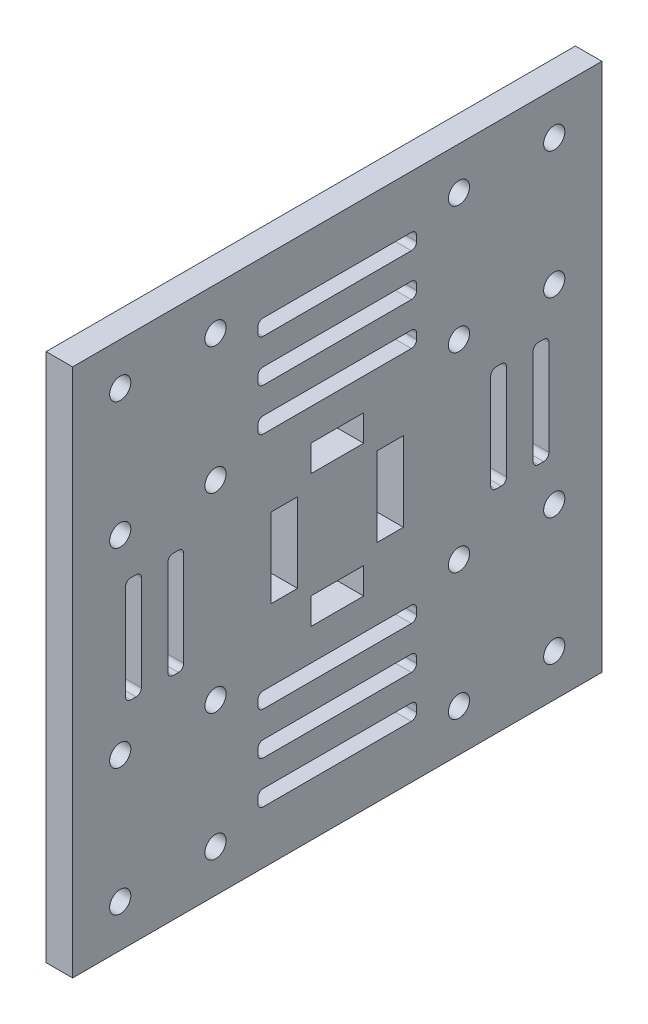
from build123d import *

# Parameters (mm, degrees)
SKETCH_1_W      = 100
SKETCH_1_H      = 100
SKETCH_1_R      = 2
SKETCH_1_W_2    = 5
SKETCH_1_H_2    = 15
SKETCH_1_W_3    = 10
SKETCH_1_H_3    = 5
EXTRUDE_1_DEPTH = 5


with BuildPart() as part:
    # 草图1 → 凸台-拉伸1 (new body)
    with BuildSketch(Plane(origin=(0, 0, 0), x_dir=(0, 0, -1), z_dir=(1, 0, 0))):
        with Locations((-50, 50)):
            Rectangle(SKETCH_1_W, SKETCH_1_H)
        with Locations((-91, 92)):
            Circle(SKETCH_1_R, mode=Mode.SUBTRACT)
        with Locations((-27, 92)):
            Circle(SKETCH_1_R, mode=Mode.SUBTRACT)
        with Locations((-91, 8)):
            Circle(SKETCH_1_R, mode=Mode.SUBTRACT)
        with Locations((-27, 8)):
            Circle(SKETCH_1_R, mode=Mode.SUBTRACT)
        with Locations((-73, 92)):
            Circle(SKETCH_1_R, mode=Mode.SUBTRACT)
        with Locations((-73, 68)):
            Circle(SKETCH_1_R, mode=Mode.SUBTRACT)
        with Locations((-91, 68)):
            Circle(SKETCH_1_R, mode=Mode.SUBTRACT)
        with Locations((-9, 92)):
            Circle(SKETCH_1_R, mode=Mode.SUBTRACT)
        with Locations((-9, 68)):
            Circle(SKETCH_1_R, mode=Mode.SUBTRACT)
        with Locations((-27, 68)):
            Circle(SKETCH_1_R, mode=Mode.SUBTRACT)
        with Locations((-73, 8)):
            Circle(SKETCH_1_R, mode=Mode.SUBTRACT)
        with Locations((-73, 32)):
            Circle(SKETCH_1_R, mode=Mode.SUBTRACT)
        with Locations((-91, 32)):
            Circle(SKETCH_1_R, mode=Mode.SUBTRACT)
        with Locations((-9, 8)):
            Circle(SKETCH_1_R, mode=Mode.SUBTRACT)
        with Locations((-9, 32)):
            Circle(SKETCH_1_R, mode=Mode.SUBTRACT)
        with Locations((-27, 32)):
            Circle(SKETCH_1_R, mode=Mode.SUBTRACT)
        with Locations((-60, 50)):
            Rectangle(SKETCH_1_W_2, SKETCH_1_H_2, mode=Mode.SUBTRACT)
        with Locations((-40, 50)):
            Rectangle(SKETCH_1_W_2, SKETCH_1_H_2, mode=Mode.SUBTRACT)
        with Locations((-50, 37.5)):
            Rectangle(SKETCH_1_W_3, SKETCH_1_H_3, mode=Mode.SUBTRACT)
        with Locations((-50, 62.5)):
            Rectangle(SKETCH_1_W_3, SKETCH_1_H_3, mode=Mode.SUBTRACT)
        with BuildLine():
            Line((-36, 74), (-64, 74))
            ThreePointArc((-64, 74), (-64.707106781, 73.707106781), (-65, 73))
            Line((-65, 73), (-65, 72))
            ThreePointArc((-65, 72), (-64.707106781, 71.292893219), (-64, 71))
            Line((-64, 71), (-36, 71))
            ThreePointArc((-36, 71), (-35.292893219, 71.292893219), (-35, 72))
            Line((-35, 72), (-35, 73))
            ThreePointArc((-35, 73), (-35.292893219, 73.707106781), (-36, 74))
        make_face(mode=Mode.SUBTRACT)
        with BuildLine():
            Line((-36, 82), (-64, 82))
            ThreePointArc((-64, 82), (-64.707106781, 81.707106781), (-65, 81))
            Line((-65, 81), (-65, 80))
            ThreePointArc((-65, 80), (-64.707106781, 79.292893219), (-64, 79))
            Line((-64, 79), (-36, 79))
            ThreePointArc((-36, 79), (-35.292893219, 79.292893219), (-35, 80))
            Line((-35, 80), (-35, 81))
            ThreePointArc((-35, 81), (-35.292893219, 81.707106781), (-36, 82))
        make_face(mode=Mode.SUBTRACT)
        with BuildLine():
            Line((-36, 90), (-64, 90))
            ThreePointArc((-64, 90), (-64.707106781, 89.707106781), (-65, 89))
            Line((-65, 89), (-65, 88))
            ThreePointArc((-65, 88), (-64.707106781, 87.292893219), (-64, 87))
            Line((-64, 87), (-36, 87))
            ThreePointArc((-36, 87), (-35.292893219, 87.292893219), (-35, 88))
            Line((-35, 88), (-35, 89))
            ThreePointArc((-35, 89), (-35.292893219, 89.707106781), (-36, 90))
        make_face(mode=Mode.SUBTRACT)
        with BuildLine():
            Line((-36, 29), (-64, 29))
            ThreePointArc((-64, 29), (-64.707106781, 28.707106781), (-65, 28))
            Line((-65, 28), (-65, 27))
            ThreePointArc((-65, 27), (-64.707106781, 26.292893219), (-64, 26))
            Line((-64, 26), (-36, 26))
            ThreePointArc((-36, 26), (-35.292893219, 26.292893219), (-35, 27))
            Line((-35, 27), (-35, 28))
            ThreePointArc((-35, 28), (-35.292893219, 28.707106781), (-36, 29))
        make_face(mode=Mode.SUBTRACT)
        with BuildLine():
            Line((-36, 21), (-64, 21))
            ThreePointArc((-64, 21), (-64.707106781, 20.707106781), (-65, 20))
            Line((-65, 20), (-65, 19))
            ThreePointArc((-65, 19), (-64.707106781, 18.292893219), (-64, 18))
            Line((-64, 18), (-36, 18))
            ThreePointArc((-36, 18), (-35.292893219, 18.292893219), (-35, 19))
            Line((-35, 19), (-35, 20))
            ThreePointArc((-35, 20), (-35.292893219, 20.707106781), (-36, 21))
        make_face(mode=Mode.SUBTRACT)
        with BuildLine():
            Line((-36, 13), (-64, 13))
            ThreePointArc((-64, 13), (-64.707106781, 12.707106781), (-65, 12))
            Line((-65, 12), (-65, 11))
            ThreePointArc((-65, 11), (-64.707106781, 10.292893219), (-64, 10))
            Line((-64, 10), (-36, 10))
            ThreePointArc((-36, 10), (-35.292893219, 10.292893219), (-35, 11))
            Line((-35, 11), (-35, 12))
            ThreePointArc((-35, 12), (-35.292893219, 12.707106781), (-36, 13))
        make_face(mode=Mode.SUBTRACT)
        with BuildLine():
            Line((-20, 60), (-19, 60))
            ThreePointArc((-19, 60), (-18.292893219, 59.707106781), (-18, 59))
            Line((-18, 59), (-18, 41))
            ThreePointArc((-18, 41), (-18.292893219, 40.292893219), (-19, 40))
            Line((-19, 40), (-20, 40))
            ThreePointArc((-20, 40), (-20.707106781, 40.292893219), (-21, 41))
            Line((-21, 41), (-21, 59))
            ThreePointArc((-21, 59), (-20.707106781, 59.707106781), (-20, 60))
        make_face(mode=Mode.SUBTRACT)
        with BuildLine():
            Line((-12, 60), (-11, 60))
            ThreePointArc((-11, 60), (-10.292893219, 59.707106781), (-10, 59))
            Line((-10, 59), (-10, 41))
            ThreePointArc((-10, 41), (-10.292893219, 40.292893219), (-11, 40))
            Line((-11, 40), (-12, 40))
            ThreePointArc((-12, 40), (-12.707106781, 40.292893219), (-13, 41))
            Line((-13, 41), (-13, 59))
            ThreePointArc((-13, 59), (-12.707106781, 59.707106781), (-12, 60))
        make_face(mode=Mode.SUBTRACT)
        with BuildLine():
            Line((-80, 60), (-81, 60))
            ThreePointArc((-81, 60), (-81.707106781, 59.707106781), (-82, 59))
            Line((-82, 59), (-82, 41))
            ThreePointArc((-82, 41), (-81.707106781, 40.292893219), (-81, 40))
            Line((-81, 40), (-80, 40))
            ThreePointArc((-80, 40), (-79.292893219, 40.292893219), (-79, 41))
            Line((-79, 41), (-79, 59))
            ThreePointArc((-79, 59), (-79.292893219, 59.707106781), (-80, 60))
        make_face(mode=Mode.SUBTRACT)
        with BuildLine():
            Line((-88, 60), (-89, 60))
            ThreePointArc((-89, 60), (-89.707106781, 59.707106781), (-90, 59))
            Line((-90, 59), (-90, 41))
            ThreePointArc((-90, 41), (-89.707106781, 40.292893219), (-89, 40))
            Line((-89, 40), (-88, 40))
            ThreePointArc((-88, 40), (-87.292893219, 40.292893219), (-87, 41))
            Line((-87, 41), (-87, 59))
            ThreePointArc((-87, 59), (-87.292893219, 59.707106781), (-88, 60))
        make_face(mode=Mode.SUBTRACT)
    extrude(amount=EXTRUDE_1_DEPTH)


solid = part.part
